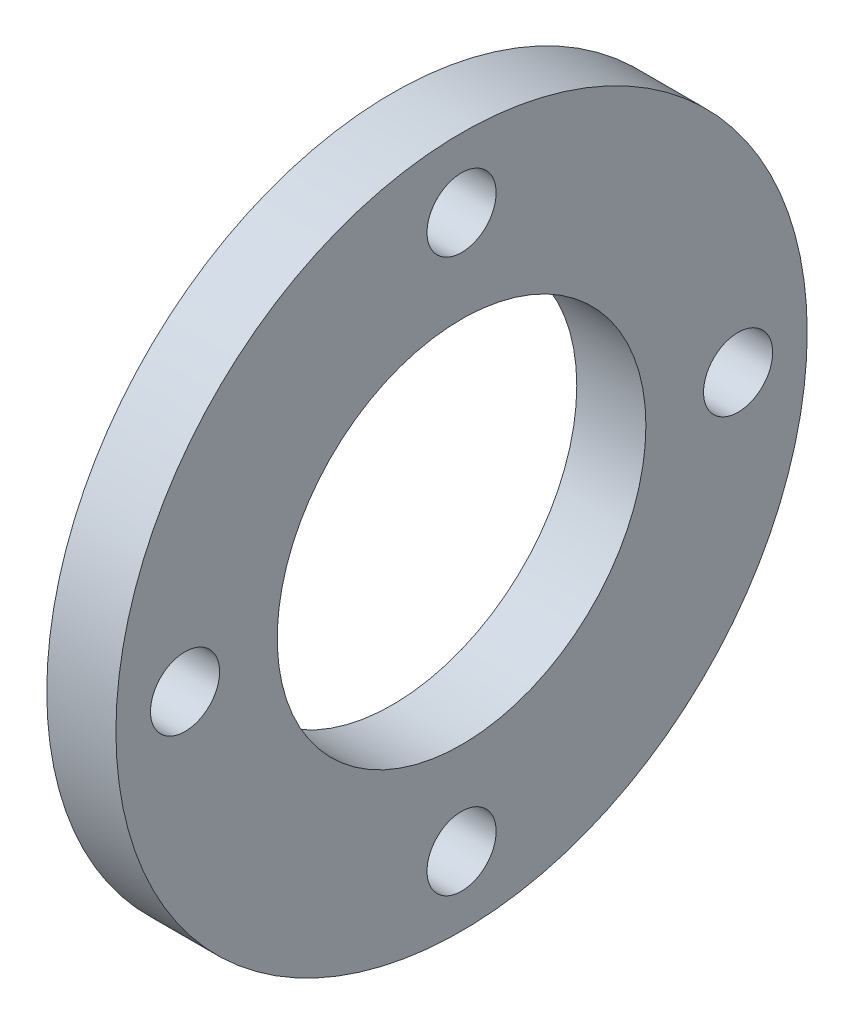
from build123d import *

# Parameters (mm, degrees)
SKETCH1_R           = 15
SKETCH1_R_2         = 8
SKETCH1_R_3         = 1.5
BOSS_EXTRUDE1_DEPTH = 3


with BuildPart() as part:
    # Sketch1 → Boss-Extrude1 (new body)
    with BuildSketch(Plane(origin=(0, 0, 0), x_dir=(0, 0, -1), z_dir=(1, 0, 0))):
        Circle(SKETCH1_R)
        Circle(SKETCH1_R_2, mode=Mode.SUBTRACT)
        with Locations((0, 12)):
            Circle(SKETCH1_R_3, mode=Mode.SUBTRACT)
        with Locations((12, 0)):
            Circle(SKETCH1_R_3, mode=Mode.SUBTRACT)
        with Locations((0, -12)):
            Circle(SKETCH1_R_3, mode=Mode.SUBTRACT)
        with Locations((-12, 0)):
            Circle(SKETCH1_R_3, mode=Mode.SUBTRACT)
    extrude(amount=BOSS_EXTRUDE1_DEPTH)


solid = part.part
